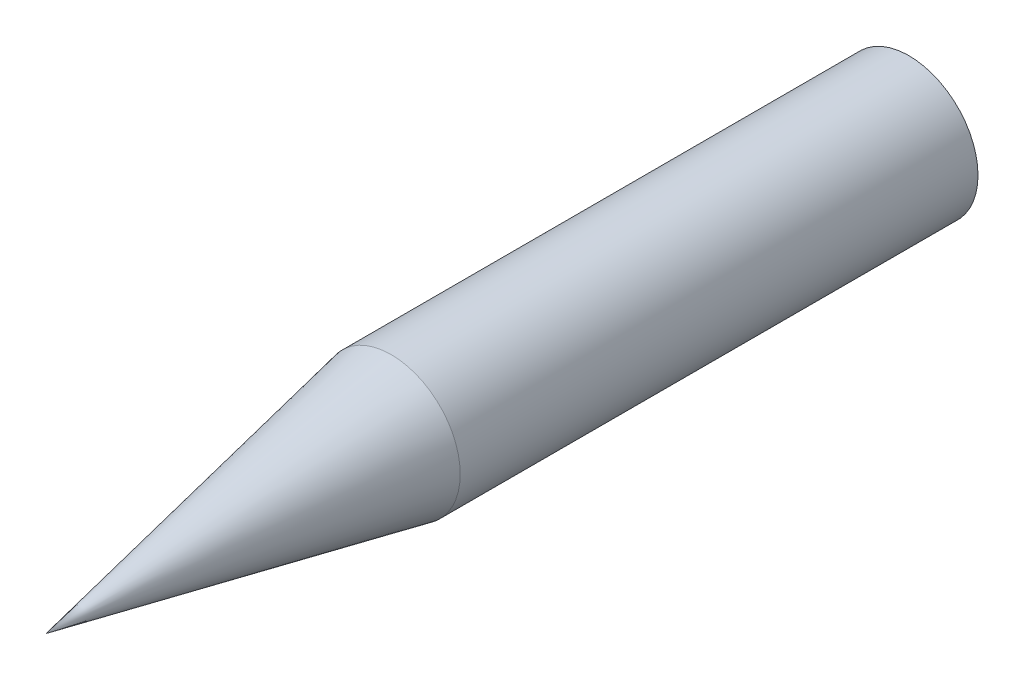
from build123d import *

# Parameters (mm, degrees)
SKETCH1_R           = 4
BOSS_EXTRUDE1_DEPTH = 50
CHAMFER1_SIZE       = 20
CHAMFER1_SIZE2      = 4


with BuildPart() as part:
    # Sketch1 → Boss-Extrude1 (new body)
    with BuildSketch(Plane.XY):
        Circle(SKETCH1_R)
    extrude(amount=BOSS_EXTRUDE1_DEPTH)

    # Chamfer1
    chamfer1_edges = [part.edges().sort_by_distance(p)[0] for p in [
        (-4, 0, 50),
    ]]
    chamfer1_side = [part.faces().sort_by_distance(p)[0] for p in [
        (-4, 0, 25),
    ]]
    chamfer(chamfer1_edges, length=CHAMFER1_SIZE, length2=CHAMFER1_SIZE2, reference=chamfer1_side[0])


solid = part.part
